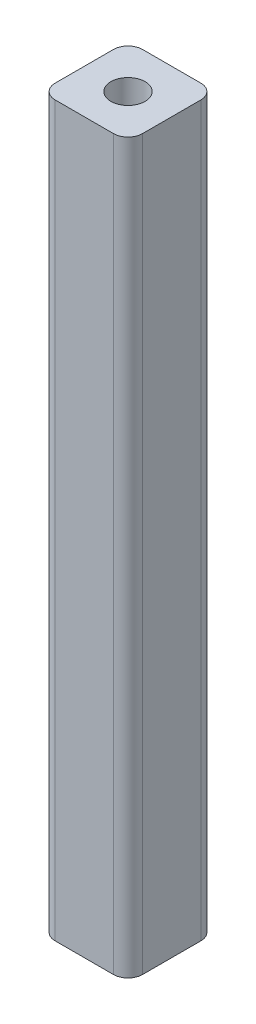
from build123d import *

# Parameters (mm, degrees)
SKETCH1_W           = 12
SKETCH1_H           = 12
SKETCH1_R           = 2.35
BOSS_EXTRUDE1_DEPTH = 100
FILLET1_R           = 2


with BuildPart() as part:
    # Sketch1 → Boss-Extrude1 (new body)
    with BuildSketch(Plane(origin=(0, 0, 0), x_dir=(1, 0, 0), z_dir=(0, 1, 0))):
        Rectangle(SKETCH1_W, SKETCH1_H)
        with Locations(Location((0, 0, 0), (0, 0, 270))):
            Circle(SKETCH1_R, mode=Mode.SUBTRACT)
    extrude(amount=BOSS_EXTRUDE1_DEPTH)

    # Fillet1
    fillet1_edges = [part.edges().sort_by_distance(p)[0] for p in [
        (-6, 50, -6),
        (6, 50, -6),
        (6, 50, 6),
        (-6, 50, 6),
    ]]
    fillet(fillet1_edges, radius=FILLET1_R)


solid = part.part
